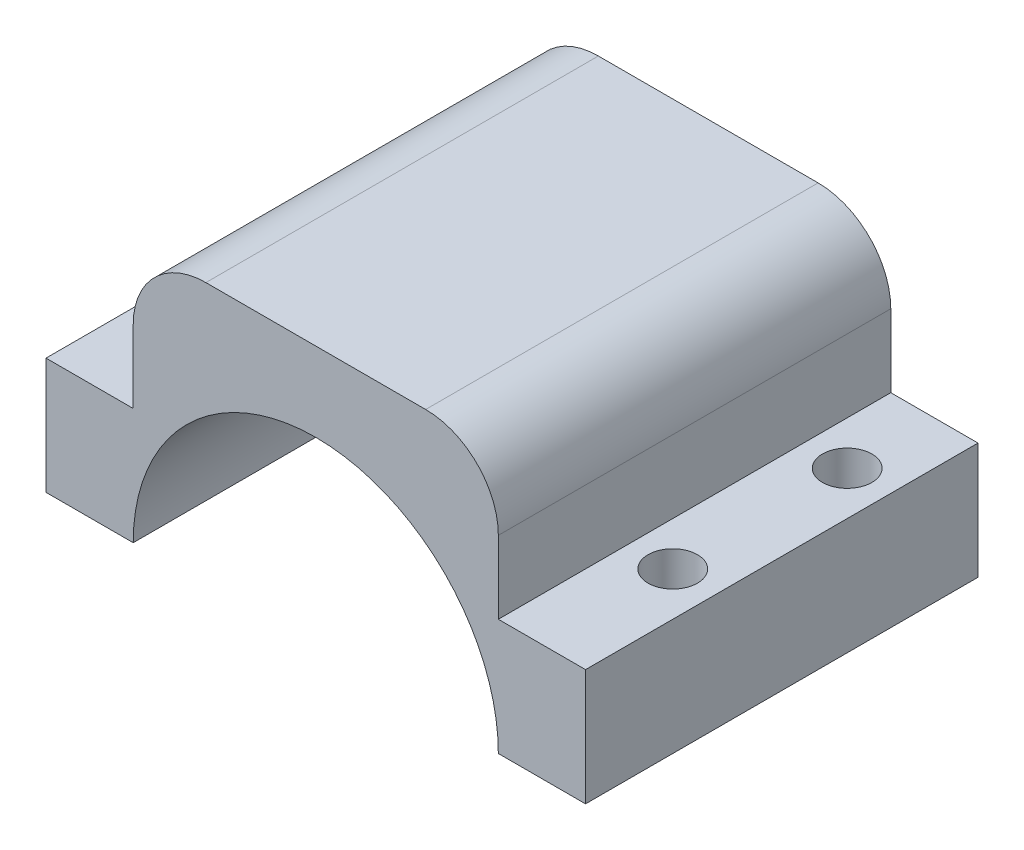
from build123d import *

# Parameters (mm, degrees)
BOSS_EXTRU_1_DEPTH      = 27
ESQUISSE5_R             = 1.7
ENL_V_MAT_EXTRU_1_DEPTH = 18
ESQUISSE6_W             = 6
ESQUISSE6_H             = 27
ENL_V_MAT_EXTRU_2_DEPTH = 10
CONG_1_R                = 5


with BuildPart() as part:
    # Esquisse1 → Boss.-Extru.1 (new body)
    with BuildSketch(Plane.XY):
        with BuildLine():
            Line((-12.560062385, 0), (-18.560062385, 0))
            Line((-18.560062385, 0), (-18.560062385, 18))
            Line((-18.560062385, 18), (18.560062385, 18))
            Line((18.560062385, 18), (18.560062385, 0))
            Line((18.560062385, 0), (12.560062385, 0))
            ThreePointArc((12.560062385, 0), (0, 12.560062385), (-12.560062385, 0))
        make_face()
    extrude(amount=BOSS_EXTRU_1_DEPTH)

    # Esquisse5 → Enlèv. mat.-Extru.1 (cut)
    with BuildSketch(Plane(origin=(0, 18, 0), x_dir=(1, 0, 0), z_dir=(0, 1, 0))):
        with Locations(Location((15.560062385, -6, 0), (0, 0, 270))):
            Circle(ESQUISSE5_R)
        with Locations(Location((15.560062385, -18, 0), (0, 0, 270))):
            Circle(ESQUISSE5_R)
        with Locations(Location((-15.560062385, -6, 0), (0, 0, 90))):
            Circle(ESQUISSE5_R)
        with Locations(Location((-15.560062385, -18, 0), (0, 0, 90))):
            Circle(ESQUISSE5_R)
    extrude(amount=-ENL_V_MAT_EXTRU_1_DEPTH, mode=Mode.SUBTRACT)

    # Esquisse6 → Enlèv. mat.-Extru.2 (cut)
    with BuildSketch(Plane(origin=(0, 18, 0), x_dir=(1, 0, 0), z_dir=(0, 1, 0))):
        with Locations((15.560062385, -13.5)):
            Rectangle(ESQUISSE6_W, ESQUISSE6_H)
        with Locations((-15.560062385, -13.5)):
            Rectangle(ESQUISSE6_W, ESQUISSE6_H)
    extrude(amount=-ENL_V_MAT_EXTRU_2_DEPTH, mode=Mode.SUBTRACT)

    # Congé1
    cong_1_edges = [part.edges().sort_by_distance(p)[0] for p in [
        (12.560062385, 18, 13.5),
        (-12.560062385, 18, 13.5),
    ]]
    fillet(cong_1_edges, radius=CONG_1_R)


solid = part.part
